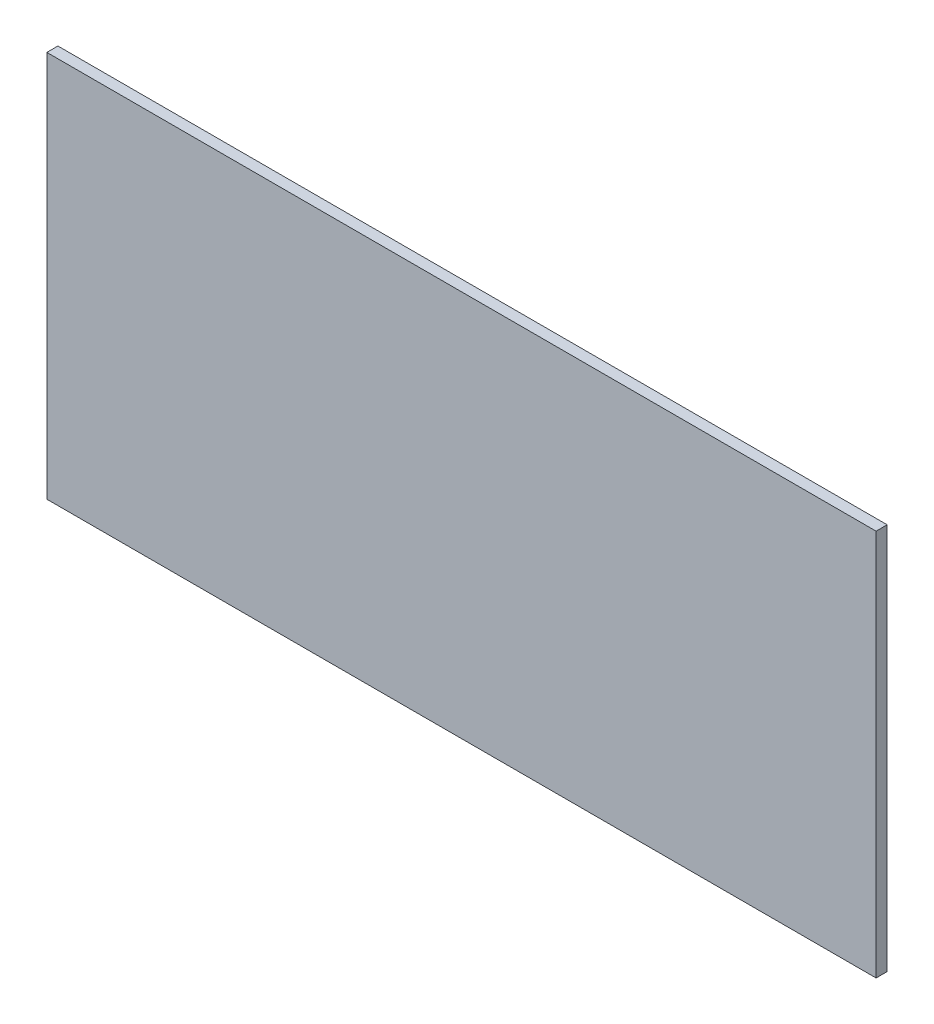
from build123d import *

# Parameters (mm, degrees)
SKETCH1_W           = 300
SKETCH1_H           = 140
BOSS_EXTRUDE1_DEPTH = 4


with BuildPart() as part:
    # Sketch1 → Boss-Extrude1 (new body)
    with BuildSketch(Plane.XY):
        with Locations((150, 70)):
            Rectangle(SKETCH1_W, SKETCH1_H)
    extrude(amount=BOSS_EXTRUDE1_DEPTH)


solid = part.part
